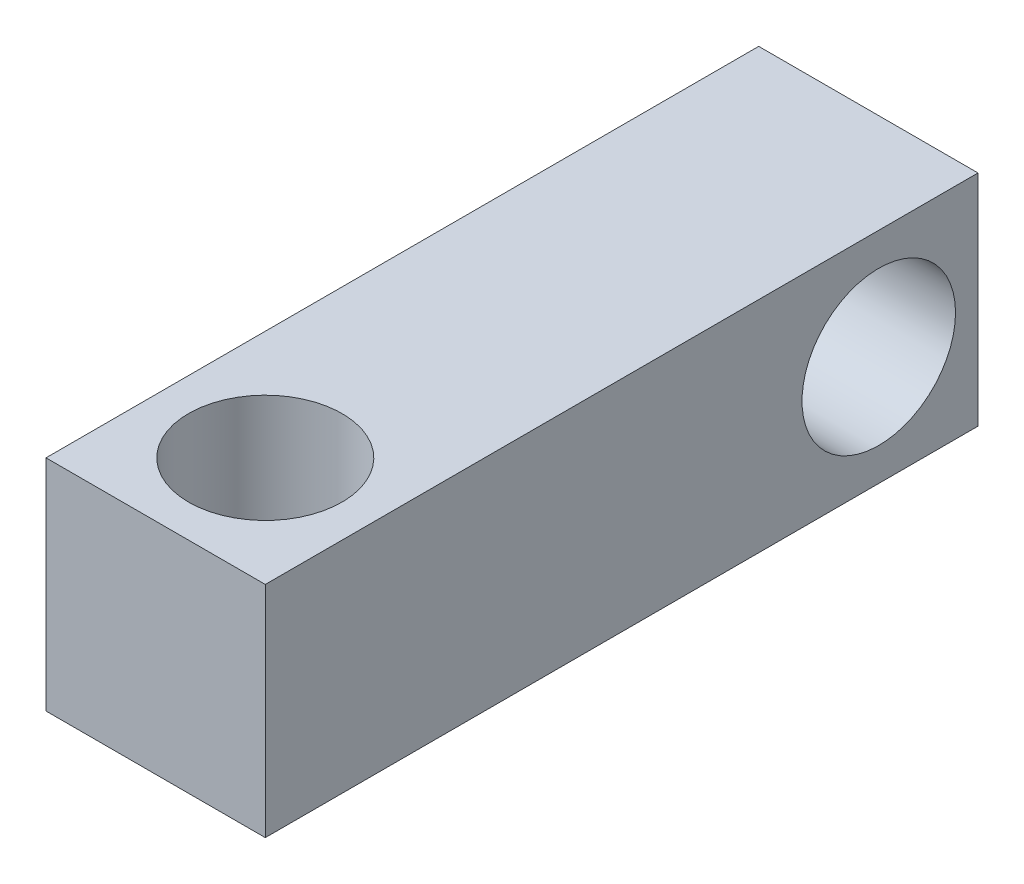
from build123d import *

# Parameters (mm, degrees)
SZKIC1_W                    = 20
SZKIC1_H                    = 20
DODANIE_WYCI_GNI_CIE1_DEPTH = 65
SZKIC2_R                    = 7
WYTNIJ_WYCI_GNI_CIE1_DEPTH  = 50
SZKIC3_R                    = 7
WYTNIJ_WYCI_GNI_CIE2_DEPTH  = 50


with BuildPart() as part:
    # Szkic1 → Dodanie-wyciągnięcie1 (new body)
    with BuildSketch(Plane.XY):
        Rectangle(SZKIC1_W, SZKIC1_H)
    extrude(amount=DODANIE_WYCI_GNI_CIE1_DEPTH)

    # Szkic2 → Wytnij-wyciągnięcie1 (cut)
    with BuildSketch(Plane(origin=(10, 0, 0), x_dir=(0, 0, -1), z_dir=(1, 0, 0))):
        with Locations((-9.050144452, 0)):
            Circle(SZKIC2_R)
    extrude(amount=-WYTNIJ_WYCI_GNI_CIE1_DEPTH, mode=Mode.SUBTRACT)

    # Szkic3 → Wytnij-wyciągnięcie2 (cut)
    with BuildSketch(Plane(origin=(0, 10, 0), x_dir=(1, 0, 0), z_dir=(0, 1, 0))):
        with Locations(Location((0, -55, 0), (0, 0, 270))):
            Circle(SZKIC3_R)
    extrude(amount=-WYTNIJ_WYCI_GNI_CIE2_DEPTH, mode=Mode.SUBTRACT)


solid = part.part
